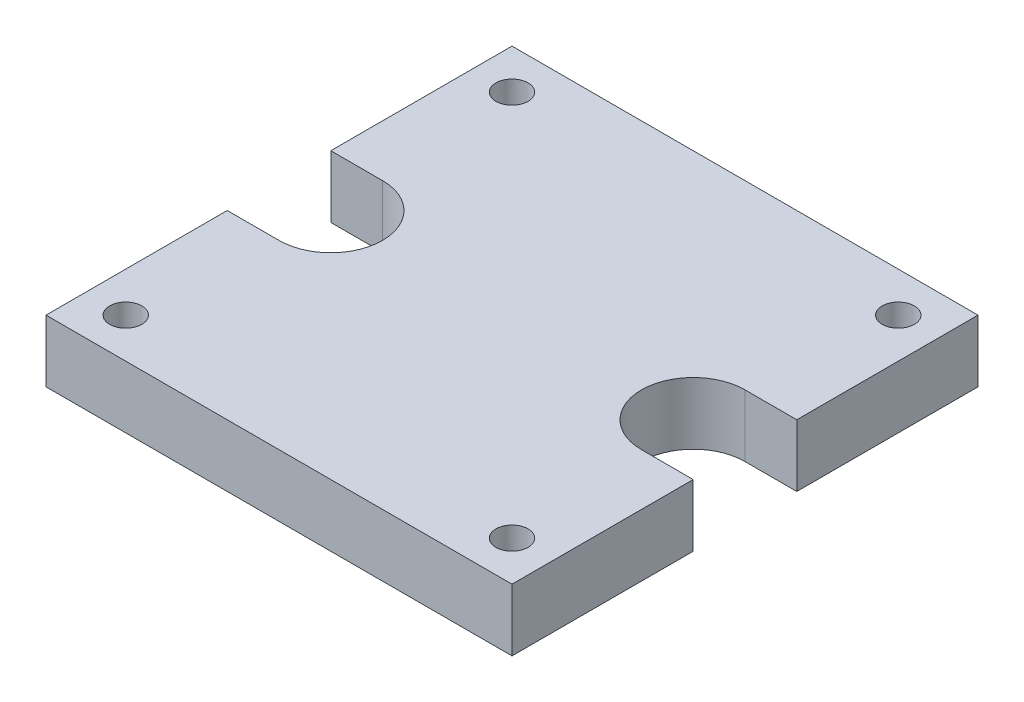
from build123d import *

# Parameters (mm, degrees)
SKETCH1_R           = 1.55
BOSS_EXTRUDE1_DEPTH = 6


with BuildPart() as part:
    # Sketch1 → Boss-Extrude1 (new body)
    with BuildSketch(Plane(origin=(0, 0, 0), x_dir=(1, 0, 0), z_dir=(0, 1, 0))):
        with BuildLine():
            Line((-22.5, -5), (-22.5, -22.5))
            Line((-22.5, -22.5), (22.5, -22.5))
            Line((22.5, -22.5), (22.5, -5))
            Line((22.5, -5), (17.5, -5))
            ThreePointArc((17.5, -5), (12.5, 0), (17.5, 5))
            Line((17.5, 5), (22.5, 5))
            Line((22.5, 5), (22.5, 22.5))
            Line((22.5, 22.5), (-22.5, 22.5))
            Line((-22.5, 22.5), (-22.5, 5))
            Line((-22.5, 5), (-17.5, 5))
            ThreePointArc((-17.5, 5), (-12.5, 0), (-17.5, -5))
            Line((-17.5, -5), (-22.5, -5))
        make_face()
        with Locations(Location((-18.65, -18.65, 0), (0, 0, 270))):
            Circle(SKETCH1_R, mode=Mode.SUBTRACT)
        with Locations(Location((18.65, -18.65, 0), (0, 0, 270))):
            Circle(SKETCH1_R, mode=Mode.SUBTRACT)
        with Locations(Location((-18.65, 18.65, 0), (0, 0, 270))):
            Circle(SKETCH1_R, mode=Mode.SUBTRACT)
        with Locations(Location((18.65, 18.65, 0), (0, 0, 270))):
            Circle(SKETCH1_R, mode=Mode.SUBTRACT)
    extrude(amount=BOSS_EXTRUDE1_DEPTH)


solid = part.part
